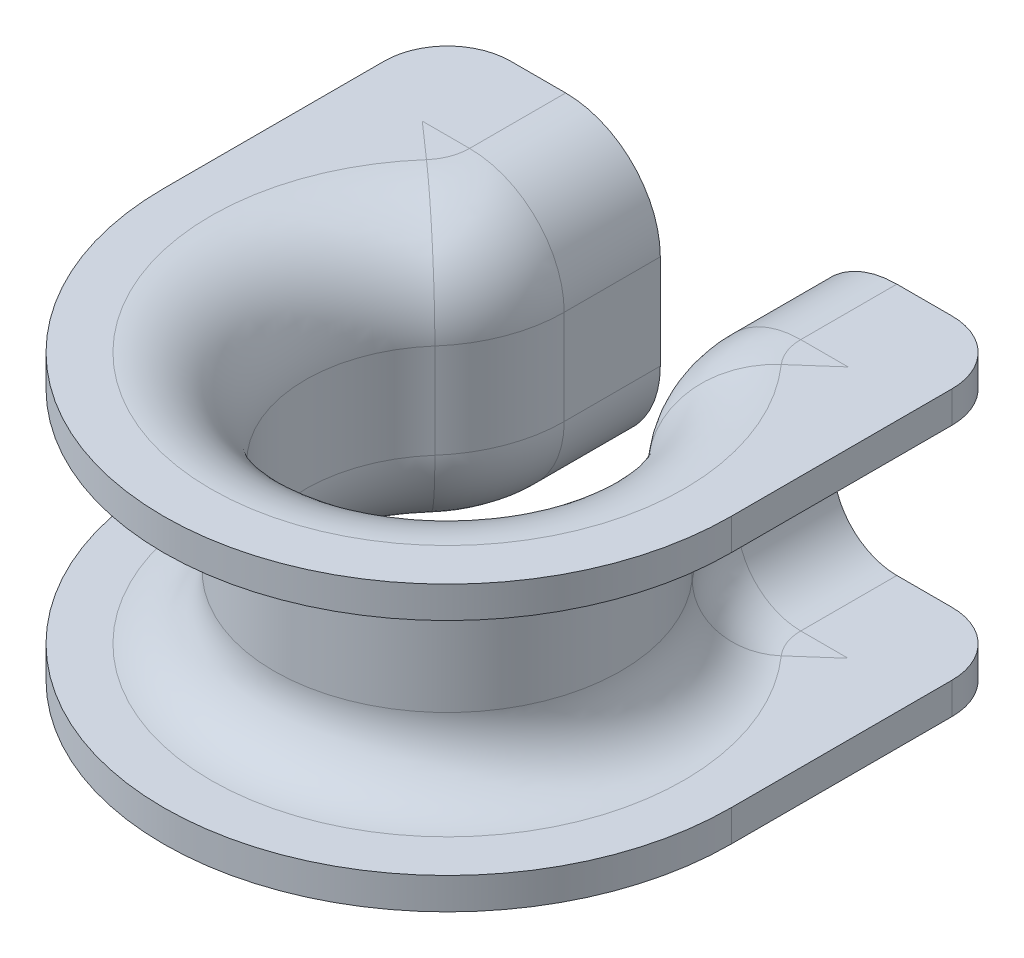
from build123d import *

# Parameters (mm, degrees)
BOSS_EXTRUDE1_REACH      = 43.243
BOSS_EXTRUDE1_END_RADIUS = 18
SKETCH3_W                = 4.5
SKETCH3_H                = 2
FILLET1_R                = 4


with BuildPart() as part:
    # Sweep1: sweep along a path in Sketch1
    with BuildLine(Plane(origin=(0, 0, 0), x_dir=(1, 0, 0), z_dir=(0, 1, 0))) as sweep1_path:
        Line((4.5, 18), (4.5, 11.9058809))
        ThreePointArc((4.5, 11.9058809), (5.08127088, 8.723900384), (6.75, 5.95294045))
        ThreePointArc((6.75, 5.95294045), (0, -9), (-6.75, 5.95294045))
        ThreePointArc((-6.75, 5.95294045), (-5.08127088, 8.723900384), (-4.5, 11.9058809))
        Line((-4.5, 11.9058809), (-4.5, 18))
    # Sketch2 → Sweep1 (sweep)
    with BuildSketch(Plane(origin=(0, 0, 0), x_dir=(0, 0, -1), z_dir=(1, 0, 0))):
        with BuildLine():
            Line((-9, -3), (-9, 3))
            ThreePointArc((-9, 3), (-10.757359313, 7.242640687), (-15, 9))
            Line((-15, 9), (-18, 9))
            Line((-18, 9), (-18, 7))
            Line((-18, 7), (-15, 7))
            ThreePointArc((-15, 7), (-12.171572875, 5.828427125), (-11, 3))
            Line((-11, 3), (-11, -3))
            ThreePointArc((-11, -3), (-12.171572875, -5.828427125), (-15, -7))
            Line((-15, -7), (-18, -7))
            Line((-18, -7), (-18, -9))
            Line((-18, -9), (-15, -9))
            ThreePointArc((-15, -9), (-10.757359313, -7.242640687), (-9, -3))
        make_face()
    sweep(path=sweep1_path.line)

    # Boss-Extrude1: up to this cylinder (the profile starts outside it)
    boss_extrude1_end = Plane(origin=(0, 0, 0), z_dir=(0, -1, 0)) * Cylinder(BOSS_EXTRUDE1_END_RADIUS, 139.486, mode=Mode.PRIVATE)
    # Sketch3 → Boss-Extrude1 (add, up to the surface)
    with BuildSketch(Plane(origin=(0, 0, -18), x_dir=(-1, 0, 0), z_dir=(0, 0, -1)), mode=Mode.PRIVATE) as boss_extrude1_sk1:
        with Locations((-15.75, -8)):
            Rectangle(SKETCH3_W, SKETCH3_H)
    boss_extrude1_tool1 = extrude(boss_extrude1_sk1.sketch, amount=-BOSS_EXTRUDE1_REACH, mode=Mode.PRIVATE) - boss_extrude1_end
    # Sketch3 → Boss-Extrude1 (add, up to the surface)
    with BuildSketch(Plane(origin=(0, 0, -18), x_dir=(-1, 0, 0), z_dir=(0, 0, -1)), mode=Mode.PRIVATE) as boss_extrude1_sk2:
        with Locations((-15.75, 8)):
            Rectangle(SKETCH3_W, SKETCH3_H)
    boss_extrude1_tool2 = extrude(boss_extrude1_sk2.sketch, amount=-BOSS_EXTRUDE1_REACH, mode=Mode.PRIVATE) - boss_extrude1_end
    boss_extrude1 = boss_extrude1_tool1.solids().sort_by_distance((15.75, -8, -18))[0] + boss_extrude1_tool2.solids().sort_by_distance((15.75, 8, -18))[0]
    add(boss_extrude1)

    # Mirror2: Boss-Extrude1 across plane
    add(boss_extrude1.mirror(Plane(origin=(0, 0, 0), x_dir=(0, 0, 1), z_dir=(1, 0, 0))))

    # Fillet1
    fillet1_edges = [part.edges().sort_by_distance(p)[0] for p in [
        (18, -8, -18),
        (18, 8, -18),
        (-18, -8, -18),
        (-18, 8, -18),
    ]]
    fillet(fillet1_edges, radius=FILLET1_R)


solid = part.part
